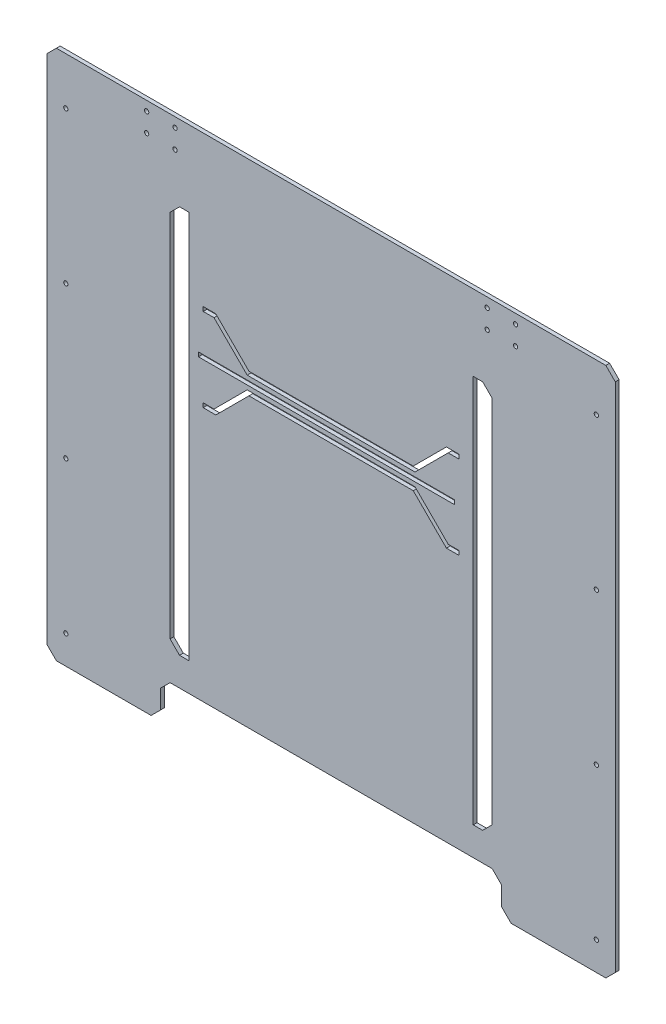
from build123d import *

# Parameters (mm, degrees)
BOSS_EXTRUDE1_DEPTH  = 4
CUT_EXTRUDE2_DEPTH   = 10
SKETCH4_W            = 270
SKETCH4_H            = 4.5
CUT_EXTRUDE5_DEPTH   = 10
CUT_EXTRUDE6_DEPTH   = 10
MIRROR9_COPY_1_DEPTH = 10
CHAMFER1_SIZE        = 10
SKETCH6_R            = 2.25
CUT_EXTRUDE7_DEPTH   = 10
SKETCH7_R            = 2.25
CUT_EXTRUDE8_DEPTH   = 10


with BuildPart() as part:
    # Sketch1 → Boss-Extrude1 (new body)
    with BuildSketch(Plane.XY):
        Polygon((440.319741737, -451.518776284), (440.319741737, -431.518776284), (430.319741737, -421.518776284), (310.319741737, -421.518776284), (210.319741737, -421.518776284), (90.319741737, -421.518776284), (80.319741737, -431.518776284), (80.319741737, -451.518776284), (70.319741737, -461.518776284), (2.319741737, -461.518776284), (-29.680258263, -461.518776284), (-39.680258263, -451.518776284), (-39.680258263, -421.518776284), (-39.680258263, -5.004819249), (-39.680258263, 98.481223716), (0.319741737, 98.481223716), (540.319741737, 98.481223716), (560.319741737, 98.481223716), (560.319741737, -5.004819249), (560.319741737, -420.004819249), (560.319741737, -451.518776284), (550.319741737, -461.518776284), (540.319741737, -461.518776284), (450.319741737, -461.518776284), align=None)
    extrude(amount=BOSS_EXTRUDE1_DEPTH)

    # Sketch3 → Cut-Extrude2 (cut)
    with BuildSketch(Plane(origin=(0, 0, 0), x_dir=(-1, 0, 0), z_dir=(0, 0, -1))):
        Polygon((-410.319741737, -391.518776284), (-420.319741737, -391.518776284), (-430.319741737, -381.518776284), (-430.319741737, 8.481223716), (-420.319741737, 18.481223716), (-410.319741737, 18.481223716), align=None)
        Polygon((-100.319741737, 18.481223716), (-90.319741737, 8.481223716), (-90.319741737, -381.518776284), (-100.319741737, -391.518776284), (-110.319741737, -391.518776284), (-110.319741737, 18.481223716), align=None)
    extrude(amount=-CUT_EXTRUDE2_DEPTH, mode=Mode.SUBTRACT)

    # Sketch4 → Cut-Extrude5 (cut)
    with BuildSketch(Plane(origin=(0, 0, 0), x_dir=(-1, 0, 0), z_dir=(0, 0, -1))):
        with Locations((-255.319741737, -106.429112329)):
            Rectangle(SKETCH4_W, SKETCH4_H)
    extrude(amount=-CUT_EXTRUDE5_DEPTH, mode=Mode.SUBTRACT)

    # Sketch5 → Cut-Extrude6 (cut)
    with BuildSketch(Plane(origin=(0, 0, 0), x_dir=(-1, 0, 0), z_dir=(0, 0, -1))):
        Polygon((-171.743467553, -99.679112329), (-260.319741737, -99.679112329), (-260.319741737, -95.179112329), (-173.607428584, -95.179112329), (-138.607428584, -60.179112329), (-125.319741737, -60.179112329), (-125.319741737, -64.679112329), (-136.743467553, -64.679112329), align=None)
    cut_extrude6 = extrude(amount=-CUT_EXTRUDE6_DEPTH, mode=Mode.SUBTRACT)

    # Mirror3: Cut-Extrude6 across plane
    add(cut_extrude6.mirror(Plane(origin=(260.319741737, -99.679112329, 10), x_dir=(0, 0, 1), z_dir=(1, 0, 0))), mode=Mode.SUBTRACT)

    # Mirror9: Cut-Extrude6 across plane
    add(cut_extrude6.mirror(Plane(origin=(0, -106.429112329, 0), x_dir=(0, 0, 1), z_dir=(0, -1, 0))), mode=Mode.SUBTRACT)

    # Mirror9 copy 1 sketch → Mirror9 copy 1 (cut)
    with BuildSketch(Plane(origin=(520.639483474, -212.858224657, 0), x_dir=(1, 0, 0), z_dir=(0, 0, -1))):
        Polygon((-171.743467553, -99.679112329), (-260.319741737, -99.679112329), (-260.319741737, -95.179112329), (-173.607428584, -95.179112329), (-138.607428584, -60.179112329), (-125.319741737, -60.179112329), (-125.319741737, -64.679112329), (-136.743467553, -64.679112329), align=None)
    extrude(amount=-MIRROR9_COPY_1_DEPTH, mode=Mode.SUBTRACT)

    # Chamfer1
    chamfer1_edges = [part.edges().sort_by_distance(p)[0] for p in [
        (-39.680258263, 98.481223716, 2),
        (560.319741737, 98.481223716, 2),
    ]]
    chamfer(chamfer1_edges, length=CHAMFER1_SIZE)

    # Sketch6 → Cut-Extrude7 (cut)
    with BuildSketch(Plane(origin=(0, 0, 0), x_dir=(-1, 0, 0), z_dir=(0, 0, -1))):
        with Locations((-540.319741737, 48.481223716)):
            Circle(SKETCH6_R)
        with Locations((-540.319741737, -111.518776284)):
            Circle(SKETCH6_R)
        with Locations((-540.319741737, -271.518776284)):
            Circle(SKETCH6_R)
        with Locations((-540.319741737, -431.518776284)):
            Circle(SKETCH6_R)
    cut_extrude7 = extrude(amount=-CUT_EXTRUDE7_DEPTH, mode=Mode.SUBTRACT)

    # Mirror10: Cut-Extrude7 across plane
    add(cut_extrude7.mirror(Plane(origin=(260.319741737, 0, 0), x_dir=(0, 0, 1), z_dir=(1, 0, 0))), mode=Mode.SUBTRACT)

    # Sketch7 → Cut-Extrude8 (cut)
    with BuildSketch(Plane.XY.offset(4)):
        with Locations((65.604902337, 88.481223716)):
            Circle(SKETCH7_R)
        with Locations((95.604902337, 88.481223716)):
            Circle(SKETCH7_R)
        with Locations((95.604902337, 68.481223716)):
            Circle(SKETCH7_R)
        with Locations((65.604902337, 68.481223716)):
            Circle(SKETCH7_R)
    cut_extrude8 = extrude(amount=-CUT_EXTRUDE8_DEPTH, mode=Mode.SUBTRACT)

    # Mirror11: Cut-Extrude8 across plane
    add(cut_extrude8.mirror(Plane(origin=(260.319741737, 0, 0), x_dir=(0, 0, 1), z_dir=(1, 0, 0))), mode=Mode.SUBTRACT)


solid = part.part
